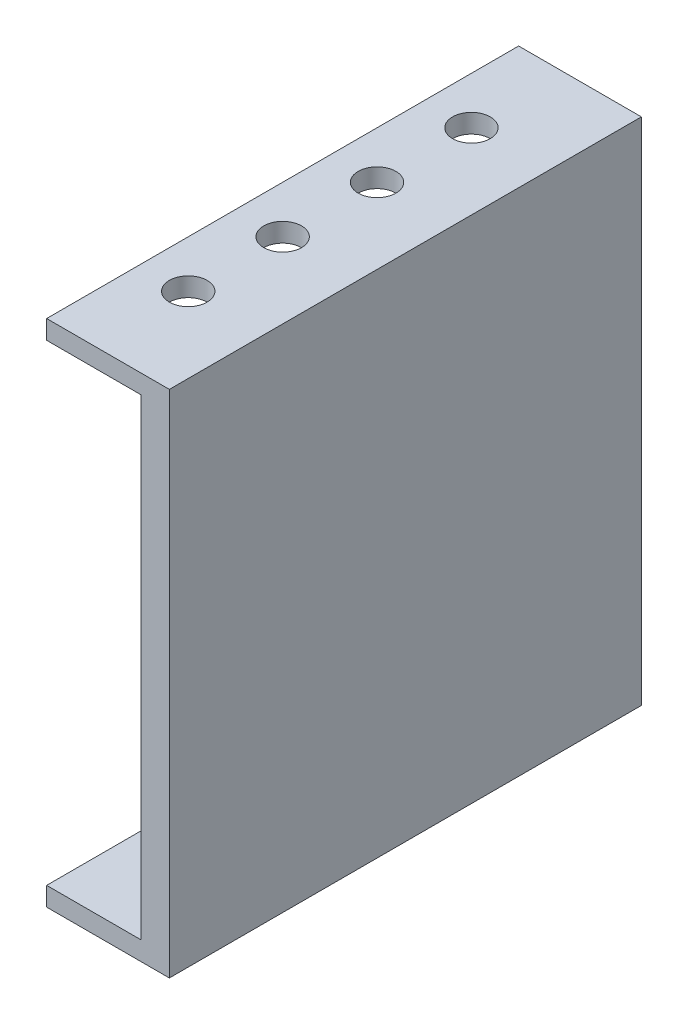
from build123d import *

# Parameters (mm, degrees)
SKETCH_1_W          = 10
SKETCH_1_H          = 50
EXTRUDE_1_DEPTH     = 2
SKETCH_2_W          = 50
SKETCH_2_H          = 2
EXTRUDE_2_DEPTH     = 3
SKETCH_3_W          = 3
SKETCH_3_H          = 50
EXTRUDE_3_DEPTH     = 52
SKETCH_4_W          = 50
SKETCH_4_H          = 2
EXTRUDE_4_DEPTH     = 10
SKETCH_5_R          = 2
CUT_EXTRUDE_1_DEPTH = 61.041652209
SKETCH_6_W          = 50
SKETCH_6_H          = 54
EXTRUDE_5_DEPTH     = 1.5
SKETCH_7_W          = 50
SKETCH_7_H          = 50
CUT_EXTRUDE_2_DEPTH = 1.5
SKETCH_8_W          = 50
SKETCH_8_H          = 2
CUT_EXTRUDE_3_DEPTH = 1.5


with BuildPart() as part:
    # 草图1 → 凸台-拉伸1 (new body)
    with BuildSketch(Plane(origin=(0, 0, 0), x_dir=(1, 0, 0), z_dir=(0, 1, 0))):
        Rectangle(SKETCH_1_W, SKETCH_1_H)
    extrude(amount=EXTRUDE_1_DEPTH)

    # 草图2 → 凸台-拉伸2 (add)
    with BuildSketch(Plane(origin=(5, 0, 0), x_dir=(0, 0, -1), z_dir=(1, 0, 0))):
        with Locations((0, 1)):
            Rectangle(SKETCH_2_W, SKETCH_2_H)
    extrude(amount=EXTRUDE_2_DEPTH)

    # 草图3 → 凸台-拉伸3 (add)
    with BuildSketch(Plane.XZ):
        with Locations((6.5, 0)):
            Rectangle(SKETCH_3_W, SKETCH_3_H)
    extrude(amount=EXTRUDE_3_DEPTH)

    # 草图4 → 凸台-拉伸4 (add)
    with BuildSketch(Plane.ZY.offset(-5)):
        with Locations((0, -51)):
            Rectangle(SKETCH_4_W, SKETCH_4_H)
    extrude(amount=EXTRUDE_4_DEPTH)

    # 草图5 → 切除-拉伸1 (cut, through all)
    with BuildSketch(Plane(origin=(0, -52, 0), x_dir=(-1, 0, 0), z_dir=(0, -1, 0))):
        with Locations(Location((-1.5, -15, 0), (0, 0, 90))):
            Circle(SKETCH_5_R)
        with Locations(Location((-1.5, -5, 0), (0, 0, 90))):
            Circle(SKETCH_5_R)
        with Locations(Location((-1.5, 5, 0), (0, 0, 90))):
            Circle(SKETCH_5_R)
        with Locations(Location((-1.5, 15, 0), (0, 0, 90))):
            Circle(SKETCH_5_R)
    extrude(amount=-CUT_EXTRUDE_1_DEPTH, mode=Mode.SUBTRACT)

    # 草图6 → 凸台-拉伸5 (add)
    with BuildSketch(Plane(origin=(8, 0, 0), x_dir=(0, 0, -1), z_dir=(1, 0, 0))):
        with Locations((0, -25)):
            Rectangle(SKETCH_6_W, SKETCH_6_H)
    extrude(amount=EXTRUDE_5_DEPTH)

    # 草图7 → 切除-拉伸2 (cut)
    with BuildSketch(Plane.ZY.offset(-5)):
        with Locations((0, -25)):
            Rectangle(SKETCH_7_W, SKETCH_7_H)
    extrude(amount=-CUT_EXTRUDE_2_DEPTH, mode=Mode.SUBTRACT)

    # 草图8 → 切除-拉伸3 (cut)
    with BuildSketch(Plane.ZY.offset(5)):
        with Locations((0, -51)):
            Rectangle(SKETCH_8_W, SKETCH_8_H)
        with Locations((0, 1)):
            Rectangle(SKETCH_8_W, SKETCH_8_H)
    extrude(amount=-CUT_EXTRUDE_3_DEPTH, mode=Mode.SUBTRACT)


solid = part.part
